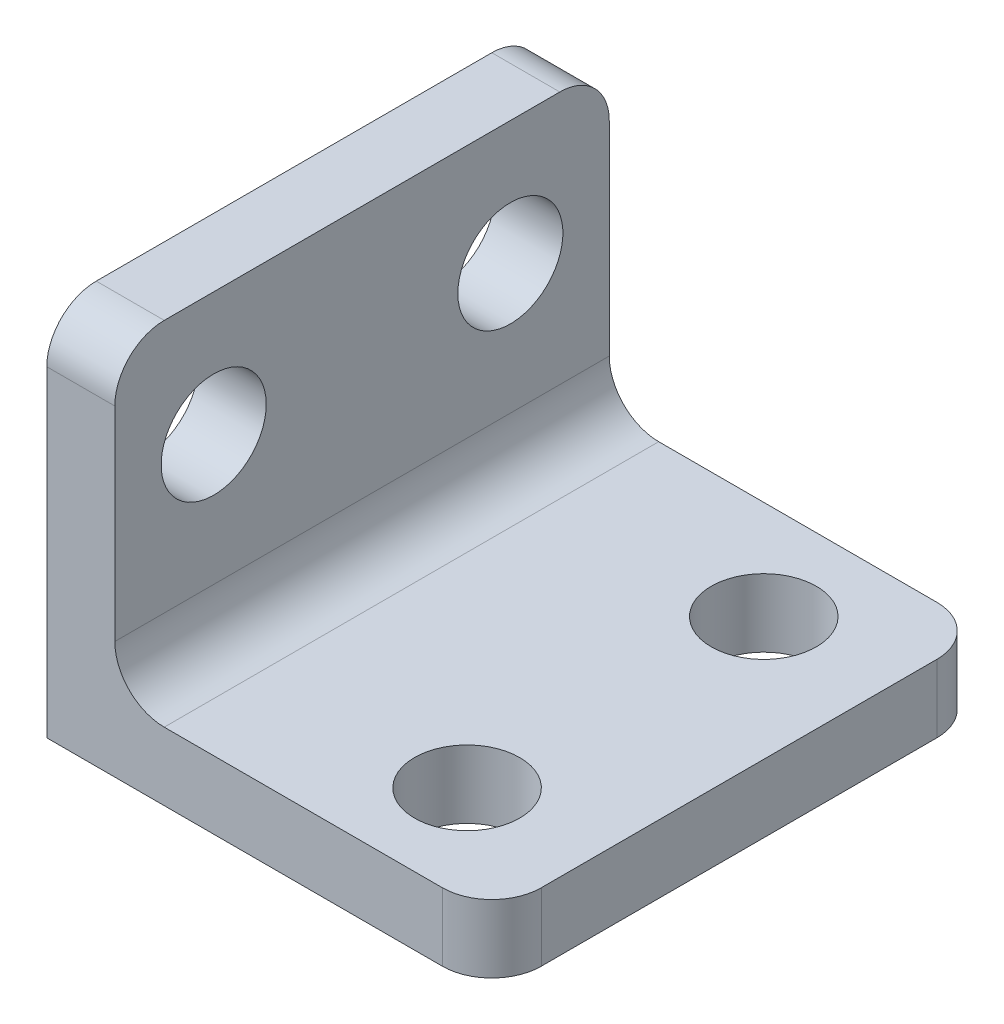
from build123d import *

# Parameters (mm, degrees)
SKETCH3_W           = 18
SKETCH3_H           = 20
SKETCH3_R           = 2.125
BOSS_EXTRUDE3_DEPTH = 2.75
SKETCH5_W           = 20
SKETCH5_H           = 15
SKETCH5_R           = 2.125
BOSS_EXTRUDE5_DEPTH = 2.75
FILLET4_R           = 2


with BuildPart() as part:
    # Sketch3 → Boss-Extrude3 (new body)
    with BuildSketch(Plane(origin=(0, 0, 0), x_dir=(1, 0, 0), z_dir=(0, 1, 0))):
        with Locations((6, 0)):
            Rectangle(SKETCH3_W, SKETCH3_H)
        with Locations(Location((10, 6, 0), (0, 0, 270))):
            Circle(SKETCH3_R, mode=Mode.SUBTRACT)
        with Locations(Location((10, -6, 0), (0, 0, 90))):
            Circle(SKETCH3_R, mode=Mode.SUBTRACT)
    extrude(amount=BOSS_EXTRUDE3_DEPTH)

    # Sketch5 → Boss-Extrude5 (add)
    with BuildSketch(Plane.ZY.offset(3)):
        with Locations((0, 7.5)):
            Rectangle(SKETCH5_W, SKETCH5_H)
        with Locations((-6, 10)):
            Circle(SKETCH5_R, mode=Mode.SUBTRACT)
        with Locations(Location((6, 10, 0), (0, 0, 180))):
            Circle(SKETCH5_R, mode=Mode.SUBTRACT)
    extrude(amount=-BOSS_EXTRUDE5_DEPTH)

    # Fillet4
    fillet4_edges = [part.edges().sort_by_distance(p)[0] for p in [
        (-1.625, 15, 10),
        (-1.625, 15, -10),
        (-0.25, 2.75, 0),
        (15, 1.375, 10),
        (15, 1.375, -10),
    ]]
    fillet(fillet4_edges, radius=FILLET4_R)


solid = part.part
